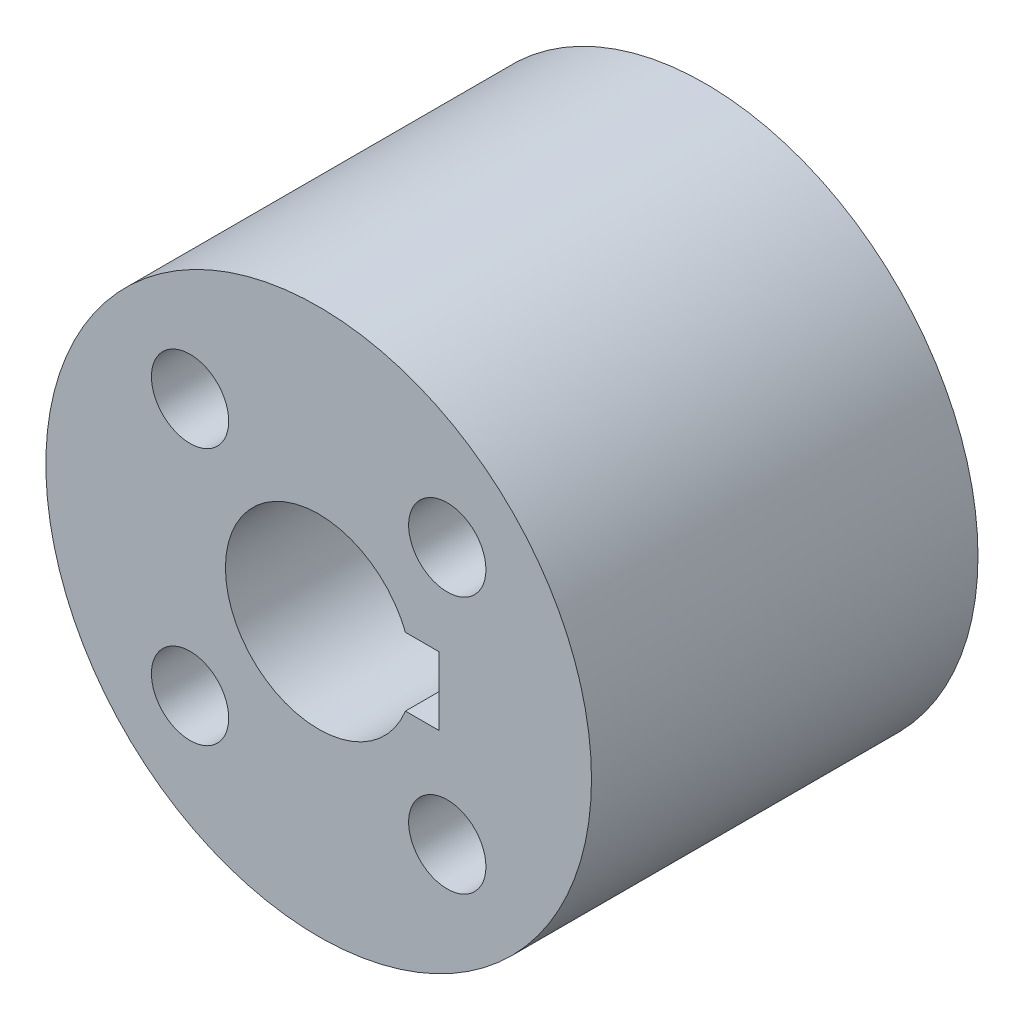
from build123d import *

# Parameters (mm, degrees)
SKIZZE1_R                       = 12
SKIZZE1_R_2                     = 1.7
AUFSATZ_LINEAR_AUSTRAGEN1_DEPTH = 17
SKIZZE3_R                       = 3.5
SCHNITT_LINEAR_AUSTRAGEN1_DEPTH = 12


with BuildPart() as part:
    # Skizze1 → Aufsatz-Linear austragen1 (new body)
    with BuildSketch(Plane.XY):
        Circle(SKIZZE1_R)
        with Locations((5.656854249, 5.656854249)):
            Circle(SKIZZE1_R_2, mode=Mode.SUBTRACT)
        with Locations((-5.656854249, 5.656854249)):
            Circle(SKIZZE1_R_2, mode=Mode.SUBTRACT)
        with Locations((-5.656854249, -5.656854249)):
            Circle(SKIZZE1_R_2, mode=Mode.SUBTRACT)
        with Locations((5.656854249, -5.656854249)):
            Circle(SKIZZE1_R_2, mode=Mode.SUBTRACT)
        with BuildLine():
            ThreePointArc((3.815756806, -1.5), (-4.1, 0), (3.815756806, 1.5))
            Line((3.815756806, 1.5), (5.3, 1.5))
            Line((5.3, 1.5), (5.3, -1.5))
            Line((5.3, -1.5), (3.815756806, -1.5))
        make_face(mode=Mode.SUBTRACT)
    extrude(amount=AUFSATZ_LINEAR_AUSTRAGEN1_DEPTH)

    # Skizze3 → Schnitt-Linear austragen1 (cut)
    with BuildSketch(Plane(origin=(0, 0, 0), x_dir=(-1, 0, 0), z_dir=(0, 0, -1))):
        with Locations((-5.656854249, 5.656854249)):
            Circle(SKIZZE3_R)
        with Locations((5.656854249, 5.656854249)):
            Circle(SKIZZE3_R)
        with Locations((5.656854249, -5.656854249)):
            Circle(SKIZZE3_R)
        with Locations((-5.656854249, -5.656854249)):
            Circle(SKIZZE3_R)
    extrude(amount=-SCHNITT_LINEAR_AUSTRAGEN1_DEPTH, mode=Mode.SUBTRACT)


solid = part.part
